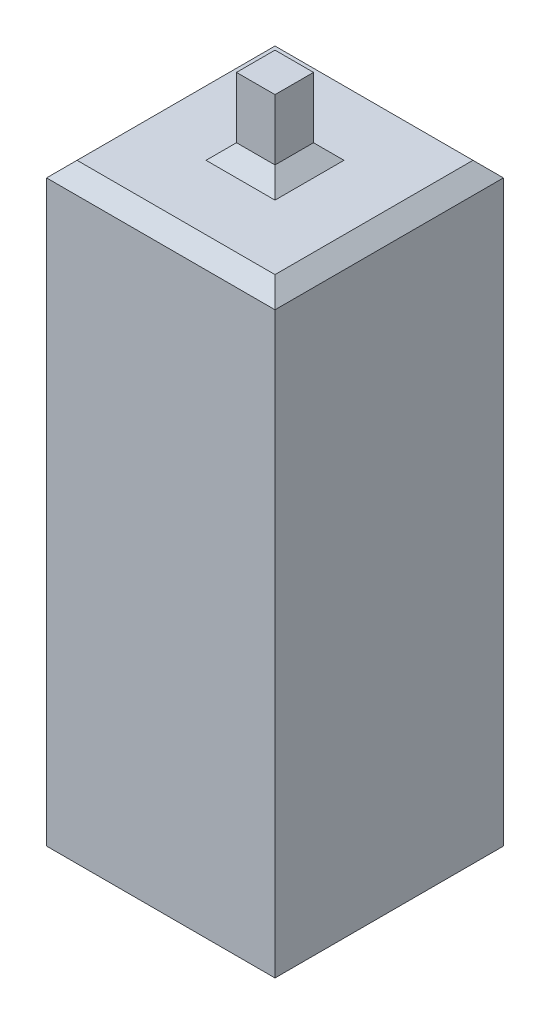
from build123d import *

# Parameters (mm, degrees)
SKETCH1_W           = 300
SKETCH1_H           = 300
BOSS_EXTRUDE1_DEPTH = 800
SKETCH2_W           = 50.59676849
SKETCH2_H           = 50.59676849
BOSS_EXTRUDE2_DEPTH = 100
CHAMFER1_SIZE       = 20


with BuildPart() as part:
    # Sketch1 → Boss-Extrude1 (new body)
    with BuildSketch(Plane(origin=(0, 0, 0), x_dir=(1, 0, 0), z_dir=(0, 1, 0))):
        Rectangle(SKETCH1_W, SKETCH1_H)
    extrude(amount=BOSS_EXTRUDE1_DEPTH)

    # Sketch2 → Boss-Extrude2 (add)
    with BuildSketch(Plane(origin=(0, 800, 0), x_dir=(1, 0, 0), z_dir=(0, 1, 0))):
        Rectangle(SKETCH2_W, SKETCH2_H)
    extrude(amount=BOSS_EXTRUDE2_DEPTH)

    # Chamfer1
    chamfer1_edges = [part.edges().sort_by_distance(p)[0] for p in [
        (-150, 800, 0),
        (25.298384245, 800, 0),
        (0, 800, -25.298384245),
        (-25.298384245, 800, 0),
        (0, 800, 150),
        (0, 800, 25.298384245),
        (150, 800, 0),
        (0, 0, 150),
        (-150, 0, 0),
        (0, 0, -150),
        (150, 0, 0),
        (0, 800, -150),
    ]]
    chamfer(chamfer1_edges, length=CHAMFER1_SIZE)


solid = part.part
